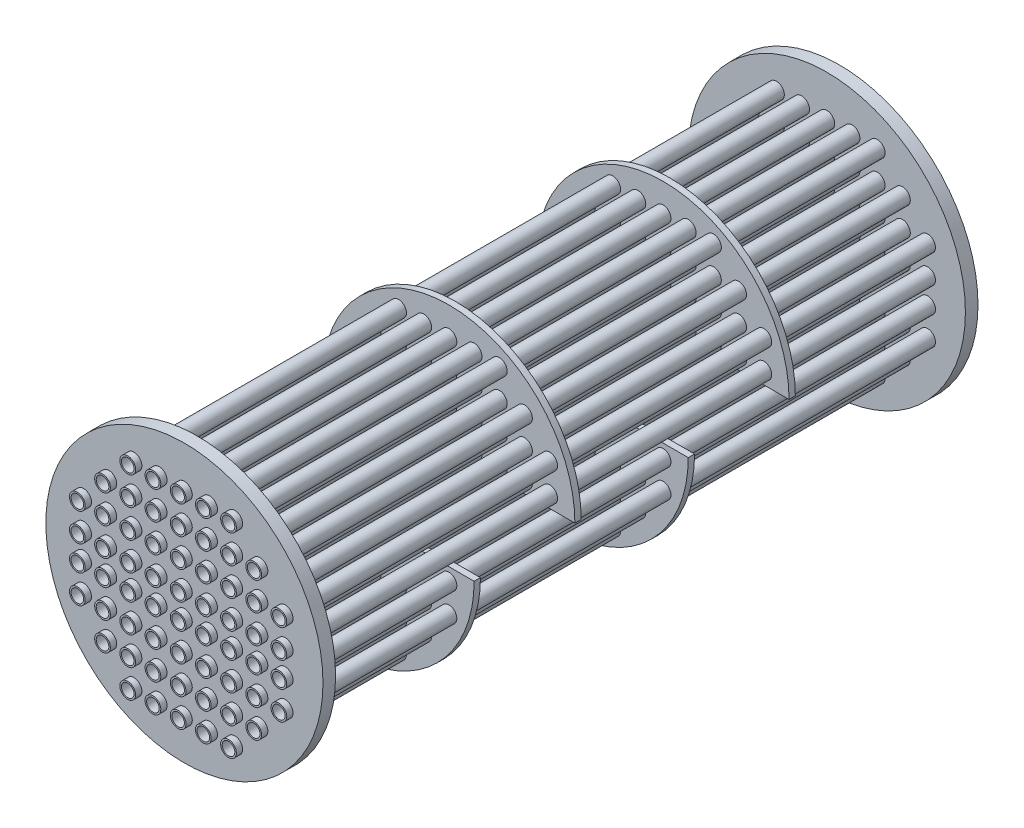
from build123d import *

# Parameters (mm, degrees)
SKETCH1_R              = 220
BOSS_EXTRUDE1_DEPTH    = 20
SKETCH3_R              = 220
BOSS_EXTRUDE2_DEPTH    = 20
BOSS_EXTRUDE3_DEPTH    = 10
BOSS_EXTRUDE4_DEPTH    = 10
BOSS_EXTRUDE5_DEPTH    = 10
BOSS_EXTRUDE6_DEPTH    = 10
SKETCH9_R              = 10
CUT_EXTRUDE1_DEPTH     = 1086.541339609
SKETCH10_R             = 12.5
SKETCH10_R_2           = 10
BOSS_EXTRUDE8_DEPTH    = 1060
BOSS_EXTRUDE8_2_DEPTH  = 1060
BOSS_EXTRUDE8_3_DEPTH  = 1060
BOSS_EXTRUDE8_4_DEPTH  = 1060
BOSS_EXTRUDE8_5_DEPTH  = 1060
BOSS_EXTRUDE8_6_DEPTH  = 1060
BOSS_EXTRUDE8_7_DEPTH  = 1060
BOSS_EXTRUDE8_8_DEPTH  = 1060
BOSS_EXTRUDE8_9_DEPTH  = 1060
BOSS_EXTRUDE8_10_DEPTH = 1060
BOSS_EXTRUDE8_11_DEPTH = 1060
BOSS_EXTRUDE8_12_DEPTH = 1060
BOSS_EXTRUDE8_13_DEPTH = 1060
BOSS_EXTRUDE8_14_DEPTH = 1060
BOSS_EXTRUDE8_15_DEPTH = 1060
BOSS_EXTRUDE8_16_DEPTH = 1060
BOSS_EXTRUDE8_17_DEPTH = 1060
BOSS_EXTRUDE8_18_DEPTH = 1060
BOSS_EXTRUDE8_19_DEPTH = 1060
BOSS_EXTRUDE8_20_DEPTH = 1060
BOSS_EXTRUDE8_21_DEPTH = 1060
BOSS_EXTRUDE8_22_DEPTH = 1060
BOSS_EXTRUDE8_23_DEPTH = 1060
BOSS_EXTRUDE8_24_DEPTH = 1060
BOSS_EXTRUDE8_25_DEPTH = 1060
BOSS_EXTRUDE8_26_DEPTH = 1060
BOSS_EXTRUDE8_27_DEPTH = 1060
BOSS_EXTRUDE8_28_DEPTH = 1060
BOSS_EXTRUDE8_29_DEPTH = 1060
BOSS_EXTRUDE8_30_DEPTH = 1060
BOSS_EXTRUDE8_31_DEPTH = 1060
BOSS_EXTRUDE8_32_DEPTH = 1060
BOSS_EXTRUDE8_33_DEPTH = 1060
BOSS_EXTRUDE8_34_DEPTH = 1060
BOSS_EXTRUDE8_35_DEPTH = 1060
BOSS_EXTRUDE8_36_DEPTH = 1060
BOSS_EXTRUDE8_37_DEPTH = 1060
BOSS_EXTRUDE8_38_DEPTH = 1060
BOSS_EXTRUDE8_39_DEPTH = 1060
BOSS_EXTRUDE8_40_DEPTH = 1060
BOSS_EXTRUDE8_41_DEPTH = 1060
BOSS_EXTRUDE8_42_DEPTH = 1060
BOSS_EXTRUDE8_43_DEPTH = 1060
BOSS_EXTRUDE8_44_DEPTH = 1060
BOSS_EXTRUDE8_45_DEPTH = 1060
BOSS_EXTRUDE8_46_DEPTH = 1060
BOSS_EXTRUDE8_47_DEPTH = 1060
BOSS_EXTRUDE8_48_DEPTH = 1060
BOSS_EXTRUDE8_49_DEPTH = 1060
BOSS_EXTRUDE8_50_DEPTH = 1060
BOSS_EXTRUDE8_51_DEPTH = 1060
BOSS_EXTRUDE8_52_DEPTH = 1060
BOSS_EXTRUDE8_53_DEPTH = 1060
BOSS_EXTRUDE8_54_DEPTH = 1060
BOSS_EXTRUDE8_55_DEPTH = 1060
BOSS_EXTRUDE8_56_DEPTH = 1060
BOSS_EXTRUDE8_57_DEPTH = 1060
BOSS_EXTRUDE8_58_DEPTH = 1060
BOSS_EXTRUDE8_59_DEPTH = 1060
BOSS_EXTRUDE8_60_DEPTH = 1060


with BuildPart() as part:
    # Sketch1 → Boss-Extrude1 (new body)
    with BuildSketch(Plane.XY):
        Circle(SKETCH1_R)
    extrude(amount=BOSS_EXTRUDE1_DEPTH)


with BuildPart() as body_2:
    # Sketch3 → Boss-Extrude2 (new body)
    with BuildSketch(Plane.XY.offset(-1000)):
        Circle(SKETCH3_R)
    extrude(amount=-BOSS_EXTRUDE2_DEPTH)


with BuildPart() as body_3:
    # Sketch4 → Boss-Extrude3 (new body)
    with BuildSketch(Plane.XY.offset(-250)):
        with BuildLine():
            Line((-200, 0), (200, 0))
            ThreePointArc((200, 0), (0, -200), (-200, 0))
        make_face()
    extrude(amount=BOSS_EXTRUDE3_DEPTH)


with BuildPart() as body_4:
    # Sketch5 → Boss-Extrude4 (new body)
    with BuildSketch(Plane.XY.offset(-410)):
        with BuildLine():
            Line((-200, 0), (200, 0))
            ThreePointArc((200, 0), (0, 200), (-200, 0))
        make_face()
    extrude(amount=BOSS_EXTRUDE4_DEPTH)


with BuildPart() as body_5:
    # Sketch6 → Boss-Extrude5 (new body)
    with BuildSketch(Plane.XY.offset(-590)):
        with BuildLine():
            Line((200, 0), (-200, 0))
            ThreePointArc((-200, 0), (0, -200), (200, 0))
        make_face()
    extrude(amount=BOSS_EXTRUDE5_DEPTH)


with BuildPart() as body_6:
    # Sketch8 → Boss-Extrude6 (new body)
    with BuildSketch(Plane.XY.offset(-750)):
        with BuildLine():
            Line((-200, 0), (200, 0))
            ThreePointArc((200, 0), (0, 200), (-200, 0))
        make_face()
    extrude(amount=BOSS_EXTRUDE6_DEPTH)


with BuildPart() as cut_extrude1_tool:
    # Sketch9 → Cut-Extrude1 (new, through all)
    with BuildSketch(Plane.XY.offset(20)):
        with Locations((0, 20)):
            Circle(SKETCH9_R)
        with Locations((0, 65)):
            Circle(SKETCH9_R)
        with Locations((0, 110)):
            Circle(SKETCH9_R)
        with Locations((0, 155)):
            Circle(SKETCH9_R)
        with Locations((40, 20)):
            Circle(SKETCH9_R)
        with Locations((40, 65)):
            Circle(SKETCH9_R)
        with Locations((40, 110)):
            Circle(SKETCH9_R)
        with Locations((40, 155)):
            Circle(SKETCH9_R)
        with Locations((80, 20)):
            Circle(SKETCH9_R)
        with Locations((80, 65)):
            Circle(SKETCH9_R)
        with Locations((80, 110)):
            Circle(SKETCH9_R)
        with Locations((80, 155)):
            Circle(SKETCH9_R)
        with Locations((120, 20)):
            Circle(SKETCH9_R)
        with Locations((120, 65)):
            Circle(SKETCH9_R)
        with Locations((120, 110)):
            Circle(SKETCH9_R)
        with Locations((160, 20)):
            Circle(SKETCH9_R)
        with Locations((160, 65)):
            Circle(SKETCH9_R)
        with Locations((-160, 65)):
            Circle(SKETCH9_R)
        with Locations((-160, 20)):
            Circle(SKETCH9_R)
        with Locations((-120, 110)):
            Circle(SKETCH9_R)
        with Locations((-120, 65)):
            Circle(SKETCH9_R)
        with Locations((-120, 20)):
            Circle(SKETCH9_R)
        with Locations((-80, 155)):
            Circle(SKETCH9_R)
        with Locations((-80, 110)):
            Circle(SKETCH9_R)
        with Locations((-80, 65)):
            Circle(SKETCH9_R)
        with Locations((-80, 20)):
            Circle(SKETCH9_R)
        with Locations((-40, 155)):
            Circle(SKETCH9_R)
        with Locations((-40, 110)):
            Circle(SKETCH9_R)
        with Locations((-40, 65)):
            Circle(SKETCH9_R)
        with Locations((-40, 20)):
            Circle(SKETCH9_R)
        with Locations((-40, -20)):
            Circle(SKETCH9_R)
        with Locations((-40, -65)):
            Circle(SKETCH9_R)
        with Locations((-40, -110)):
            Circle(SKETCH9_R)
        with Locations((-40, -155)):
            Circle(SKETCH9_R)
        with Locations((-80, -20)):
            Circle(SKETCH9_R)
        with Locations((-80, -65)):
            Circle(SKETCH9_R)
        with Locations((-80, -110)):
            Circle(SKETCH9_R)
        with Locations((-80, -155)):
            Circle(SKETCH9_R)
        with Locations((-120, -20)):
            Circle(SKETCH9_R)
        with Locations((-120, -65)):
            Circle(SKETCH9_R)
        with Locations((-120, -110)):
            Circle(SKETCH9_R)
        with Locations((-160, -20)):
            Circle(SKETCH9_R)
        with Locations((-160, -65)):
            Circle(SKETCH9_R)
        with Locations((160, -65)):
            Circle(SKETCH9_R)
        with Locations((160, -20)):
            Circle(SKETCH9_R)
        with Locations((120, -110)):
            Circle(SKETCH9_R)
        with Locations((120, -65)):
            Circle(SKETCH9_R)
        with Locations((120, -20)):
            Circle(SKETCH9_R)
        with Locations((80, -155)):
            Circle(SKETCH9_R)
        with Locations((80, -110)):
            Circle(SKETCH9_R)
        with Locations((80, -65)):
            Circle(SKETCH9_R)
        with Locations((80, -20)):
            Circle(SKETCH9_R)
        with Locations((40, -155)):
            Circle(SKETCH9_R)
        with Locations((40, -110)):
            Circle(SKETCH9_R)
        with Locations((40, -65)):
            Circle(SKETCH9_R)
        with Locations((40, -20)):
            Circle(SKETCH9_R)
        with Locations((0, -155)):
            Circle(SKETCH9_R)
        with Locations((0, -110)):
            Circle(SKETCH9_R)
        with Locations((0, -65)):
            Circle(SKETCH9_R)
        with Locations((0, -20)):
            Circle(SKETCH9_R)
    extrude(amount=-CUT_EXTRUDE1_DEPTH)


with BuildPart() as part_1:
    add(part.part)

    # Cut-Extrude1: cut by cut_extrude1_tool
    add(cut_extrude1_tool.part, mode=Mode.SUBTRACT)


with BuildPart() as body_2_1:
    add(body_2.part)

    # Cut-Extrude1: cut by cut_extrude1_tool
    add(cut_extrude1_tool.part, mode=Mode.SUBTRACT)


with BuildPart() as body_3_1:
    add(body_3.part)

    # Cut-Extrude1: cut by cut_extrude1_tool
    add(cut_extrude1_tool.part, mode=Mode.SUBTRACT)


with BuildPart() as body_4_1:
    add(body_4.part)

    # Cut-Extrude1: cut by cut_extrude1_tool
    add(cut_extrude1_tool.part, mode=Mode.SUBTRACT)


with BuildPart() as body_5_1:
    add(body_5.part)

    # Cut-Extrude1: cut by cut_extrude1_tool
    add(cut_extrude1_tool.part, mode=Mode.SUBTRACT)


with BuildPart() as body_6_1:
    add(body_6.part)

    # Cut-Extrude1: cut by cut_extrude1_tool
    add(cut_extrude1_tool.part, mode=Mode.SUBTRACT)


with BuildPart() as body_7:
    # Sketch10 → Boss-Extrude8 (new body)
    with BuildSketch(Plane.XY.offset(30)):
        with Locations((0, -155)):
            Circle(SKETCH10_R)
        with Locations((0, -155)):
            Circle(SKETCH10_R_2, mode=Mode.SUBTRACT)
    extrude(amount=-BOSS_EXTRUDE8_DEPTH)


with BuildPart() as body_8:
    # Sketch10 → Boss-Extrude8 2 (new body)
    with BuildSketch(Plane.XY.offset(30)):
        with Locations((0, -110)):
            Circle(SKETCH10_R)
        with Locations((0, -110)):
            Circle(SKETCH10_R_2, mode=Mode.SUBTRACT)
    extrude(amount=-BOSS_EXTRUDE8_2_DEPTH)


with BuildPart() as body_9:
    # Sketch10 → Boss-Extrude8 3 (new body)
    with BuildSketch(Plane.XY.offset(30)):
        with Locations((0, -65)):
            Circle(SKETCH10_R)
        with Locations((0, -65)):
            Circle(SKETCH10_R_2, mode=Mode.SUBTRACT)
    extrude(amount=-BOSS_EXTRUDE8_3_DEPTH)


with BuildPart() as body_10:
    # Sketch10 → Boss-Extrude8 4 (new body)
    with BuildSketch(Plane.XY.offset(30)):
        with Locations((0, -20)):
            Circle(SKETCH10_R)
        with Locations((0, -20)):
            Circle(SKETCH10_R_2, mode=Mode.SUBTRACT)
    extrude(amount=-BOSS_EXTRUDE8_4_DEPTH)


with BuildPart() as body_11:
    # Sketch10 → Boss-Extrude8 5 (new body)
    with BuildSketch(Plane.XY.offset(30)):
        with Locations((0, 20)):
            Circle(SKETCH10_R)
        with Locations((0, 20)):
            Circle(SKETCH10_R_2, mode=Mode.SUBTRACT)
    extrude(amount=-BOSS_EXTRUDE8_5_DEPTH)


with BuildPart() as body_12:
    # Sketch10 → Boss-Extrude8 6 (new body)
    with BuildSketch(Plane.XY.offset(30)):
        with Locations((0, 65)):
            Circle(SKETCH10_R)
        with Locations((0, 65)):
            Circle(SKETCH10_R_2, mode=Mode.SUBTRACT)
    extrude(amount=-BOSS_EXTRUDE8_6_DEPTH)


with BuildPart() as body_13:
    # Sketch10 → Boss-Extrude8 7 (new body)
    with BuildSketch(Plane.XY.offset(30)):
        with Locations((0, 110)):
            Circle(SKETCH10_R)
        with Locations((0, 110)):
            Circle(SKETCH10_R_2, mode=Mode.SUBTRACT)
    extrude(amount=-BOSS_EXTRUDE8_7_DEPTH)


with BuildPart() as body_14:
    # Sketch10 → Boss-Extrude8 8 (new body)
    with BuildSketch(Plane.XY.offset(30)):
        with Locations((0, 155)):
            Circle(SKETCH10_R)
        with Locations((0, 155)):
            Circle(SKETCH10_R_2, mode=Mode.SUBTRACT)
    extrude(amount=-BOSS_EXTRUDE8_8_DEPTH)


with BuildPart() as body_15:
    # Sketch10 → Boss-Extrude8 9 (new body)
    with BuildSketch(Plane.XY.offset(30)):
        with Locations((-80, -155)):
            Circle(SKETCH10_R)
        with Locations((-80, -155)):
            Circle(SKETCH10_R_2, mode=Mode.SUBTRACT)
    extrude(amount=-BOSS_EXTRUDE8_9_DEPTH)


with BuildPart() as body_16:
    # Sketch10 → Boss-Extrude8 10 (new body)
    with BuildSketch(Plane.XY.offset(30)):
        with Locations((-40, -155)):
            Circle(SKETCH10_R)
        with Locations((-40, -155)):
            Circle(SKETCH10_R_2, mode=Mode.SUBTRACT)
    extrude(amount=-BOSS_EXTRUDE8_10_DEPTH)


with BuildPart() as body_17:
    # Sketch10 → Boss-Extrude8 11 (new body)
    with BuildSketch(Plane.XY.offset(30)):
        with Locations((80, -155)):
            Circle(SKETCH10_R)
        with Locations((80, -155)):
            Circle(SKETCH10_R_2, mode=Mode.SUBTRACT)
    extrude(amount=-BOSS_EXTRUDE8_11_DEPTH)


with BuildPart() as body_18:
    # Sketch10 → Boss-Extrude8 12 (new body)
    with BuildSketch(Plane.XY.offset(30)):
        with Locations((40, -155)):
            Circle(SKETCH10_R)
        with Locations((40, -155)):
            Circle(SKETCH10_R_2, mode=Mode.SUBTRACT)
    extrude(amount=-BOSS_EXTRUDE8_12_DEPTH)


with BuildPart() as body_19:
    # Sketch10 → Boss-Extrude8 13 (new body)
    with BuildSketch(Plane.XY.offset(30)):
        with Locations((-80, 20)):
            Circle(SKETCH10_R)
        with Locations((-80, 20)):
            Circle(SKETCH10_R_2, mode=Mode.SUBTRACT)
    extrude(amount=-BOSS_EXTRUDE8_13_DEPTH)


with BuildPart() as body_20:
    # Sketch10 → Boss-Extrude8 14 (new body)
    with BuildSketch(Plane.XY.offset(30)):
        with Locations((-40, 20)):
            Circle(SKETCH10_R)
        with Locations((-40, 20)):
            Circle(SKETCH10_R_2, mode=Mode.SUBTRACT)
    extrude(amount=-BOSS_EXTRUDE8_14_DEPTH)


with BuildPart() as body_21:
    # Sketch10 → Boss-Extrude8 15 (new body)
    with BuildSketch(Plane.XY.offset(30)):
        with Locations((-80, -110)):
            Circle(SKETCH10_R)
        with Locations((-80, -110)):
            Circle(SKETCH10_R_2, mode=Mode.SUBTRACT)
    extrude(amount=-BOSS_EXTRUDE8_15_DEPTH)


with BuildPart() as body_22:
    # Sketch10 → Boss-Extrude8 16 (new body)
    with BuildSketch(Plane.XY.offset(30)):
        with Locations((-120, -110)):
            Circle(SKETCH10_R)
        with Locations((-120, -110)):
            Circle(SKETCH10_R_2, mode=Mode.SUBTRACT)
    extrude(amount=-BOSS_EXTRUDE8_16_DEPTH)


with BuildPart() as body_23:
    # Sketch10 → Boss-Extrude8 17 (new body)
    with BuildSketch(Plane.XY.offset(30)):
        with Locations((-120, -65)):
            Circle(SKETCH10_R)
        with Locations((-120, -65)):
            Circle(SKETCH10_R_2, mode=Mode.SUBTRACT)
    extrude(amount=-BOSS_EXTRUDE8_17_DEPTH)


with BuildPart() as body_24:
    # Sketch10 → Boss-Extrude8 18 (new body)
    with BuildSketch(Plane.XY.offset(30)):
        with Locations((-120, -20)):
            Circle(SKETCH10_R)
        with Locations((-120, -20)):
            Circle(SKETCH10_R_2, mode=Mode.SUBTRACT)
    extrude(amount=-BOSS_EXTRUDE8_18_DEPTH)


with BuildPart() as body_25:
    # Sketch10 → Boss-Extrude8 19 (new body)
    with BuildSketch(Plane.XY.offset(30)):
        with Locations((-160, -65)):
            Circle(SKETCH10_R)
        with Locations((-160, -65)):
            Circle(SKETCH10_R_2, mode=Mode.SUBTRACT)
    extrude(amount=-BOSS_EXTRUDE8_19_DEPTH)


with BuildPart() as body_26:
    # Sketch10 → Boss-Extrude8 20 (new body)
    with BuildSketch(Plane.XY.offset(30)):
        with Locations((-160, -20)):
            Circle(SKETCH10_R)
        with Locations((-160, -20)):
            Circle(SKETCH10_R_2, mode=Mode.SUBTRACT)
    extrude(amount=-BOSS_EXTRUDE8_20_DEPTH)


with BuildPart() as body_27:
    # Sketch10 → Boss-Extrude8 21 (new body)
    with BuildSketch(Plane.XY.offset(30)):
        with Locations((-160, 20)):
            Circle(SKETCH10_R)
        with Locations((-160, 20)):
            Circle(SKETCH10_R_2, mode=Mode.SUBTRACT)
    extrude(amount=-BOSS_EXTRUDE8_21_DEPTH)


with BuildPart() as body_28:
    # Sketch10 → Boss-Extrude8 22 (new body)
    with BuildSketch(Plane.XY.offset(30)):
        with Locations((-120, 20)):
            Circle(SKETCH10_R)
        with Locations((-120, 20)):
            Circle(SKETCH10_R_2, mode=Mode.SUBTRACT)
    extrude(amount=-BOSS_EXTRUDE8_22_DEPTH)


with BuildPart() as body_29:
    # Sketch10 → Boss-Extrude8 23 (new body)
    with BuildSketch(Plane.XY.offset(30)):
        with Locations((-40, -110)):
            Circle(SKETCH10_R)
        with Locations((-40, -110)):
            Circle(SKETCH10_R_2, mode=Mode.SUBTRACT)
    extrude(amount=-BOSS_EXTRUDE8_23_DEPTH)


with BuildPart() as body_30:
    # Sketch10 → Boss-Extrude8 24 (new body)
    with BuildSketch(Plane.XY.offset(30)):
        with Locations((-40, -20)):
            Circle(SKETCH10_R)
        with Locations((-40, -20)):
            Circle(SKETCH10_R_2, mode=Mode.SUBTRACT)
    extrude(amount=-BOSS_EXTRUDE8_24_DEPTH)


with BuildPart() as body_31:
    # Sketch10 → Boss-Extrude8 25 (new body)
    with BuildSketch(Plane.XY.offset(30)):
        with Locations((-40, -65)):
            Circle(SKETCH10_R)
        with Locations((-40, -65)):
            Circle(SKETCH10_R_2, mode=Mode.SUBTRACT)
    extrude(amount=-BOSS_EXTRUDE8_25_DEPTH)


with BuildPart() as body_32:
    # Sketch10 → Boss-Extrude8 26 (new body)
    with BuildSketch(Plane.XY.offset(30)):
        with Locations((-80, -65)):
            Circle(SKETCH10_R)
        with Locations((-80, -65)):
            Circle(SKETCH10_R_2, mode=Mode.SUBTRACT)
    extrude(amount=-BOSS_EXTRUDE8_26_DEPTH)


with BuildPart() as body_33:
    # Sketch10 → Boss-Extrude8 27 (new body)
    with BuildSketch(Plane.XY.offset(30)):
        with Locations((-80, -20)):
            Circle(SKETCH10_R)
        with Locations((-80, -20)):
            Circle(SKETCH10_R_2, mode=Mode.SUBTRACT)
    extrude(amount=-BOSS_EXTRUDE8_27_DEPTH)


with BuildPart() as body_34:
    # Sketch10 → Boss-Extrude8 28 (new body)
    with BuildSketch(Plane.XY.offset(30)):
        with Locations((160, -20)):
            Circle(SKETCH10_R)
        with Locations((160, -20)):
            Circle(SKETCH10_R_2, mode=Mode.SUBTRACT)
    extrude(amount=-BOSS_EXTRUDE8_28_DEPTH)


with BuildPart() as body_35:
    # Sketch10 → Boss-Extrude8 29 (new body)
    with BuildSketch(Plane.XY.offset(30)):
        with Locations((160, 20)):
            Circle(SKETCH10_R)
        with Locations((160, 20)):
            Circle(SKETCH10_R_2, mode=Mode.SUBTRACT)
    extrude(amount=-BOSS_EXTRUDE8_29_DEPTH)


with BuildPart() as body_36:
    # Sketch10 → Boss-Extrude8 30 (new body)
    with BuildSketch(Plane.XY.offset(30)):
        with Locations((120, 20)):
            Circle(SKETCH10_R)
        with Locations((120, 20)):
            Circle(SKETCH10_R_2, mode=Mode.SUBTRACT)
    extrude(amount=-BOSS_EXTRUDE8_30_DEPTH)


with BuildPart() as body_37:
    # Sketch10 → Boss-Extrude8 31 (new body)
    with BuildSketch(Plane.XY.offset(30)):
        with Locations((80, 20)):
            Circle(SKETCH10_R)
        with Locations((80, 20)):
            Circle(SKETCH10_R_2, mode=Mode.SUBTRACT)
    extrude(amount=-BOSS_EXTRUDE8_31_DEPTH)


with BuildPart() as body_38:
    # Sketch10 → Boss-Extrude8 32 (new body)
    with BuildSketch(Plane.XY.offset(30)):
        with Locations((80, -20)):
            Circle(SKETCH10_R)
        with Locations((80, -20)):
            Circle(SKETCH10_R_2, mode=Mode.SUBTRACT)
    extrude(amount=-BOSS_EXTRUDE8_32_DEPTH)


with BuildPart() as body_39:
    # Sketch10 → Boss-Extrude8 33 (new body)
    with BuildSketch(Plane.XY.offset(30)):
        with Locations((40, -110)):
            Circle(SKETCH10_R)
        with Locations((40, -110)):
            Circle(SKETCH10_R_2, mode=Mode.SUBTRACT)
    extrude(amount=-BOSS_EXTRUDE8_33_DEPTH)


with BuildPart() as body_40:
    # Sketch10 → Boss-Extrude8 34 (new body)
    with BuildSketch(Plane.XY.offset(30)):
        with Locations((40, -65)):
            Circle(SKETCH10_R)
        with Locations((40, -65)):
            Circle(SKETCH10_R_2, mode=Mode.SUBTRACT)
    extrude(amount=-BOSS_EXTRUDE8_34_DEPTH)


with BuildPart() as body_41:
    # Sketch10 → Boss-Extrude8 35 (new body)
    with BuildSketch(Plane.XY.offset(30)):
        with Locations((40, -20)):
            Circle(SKETCH10_R)
        with Locations((40, -20)):
            Circle(SKETCH10_R_2, mode=Mode.SUBTRACT)
    extrude(amount=-BOSS_EXTRUDE8_35_DEPTH)


with BuildPart() as body_42:
    # Sketch10 → Boss-Extrude8 36 (new body)
    with BuildSketch(Plane.XY.offset(30)):
        with Locations((40, 20)):
            Circle(SKETCH10_R)
        with Locations((40, 20)):
            Circle(SKETCH10_R_2, mode=Mode.SUBTRACT)
    extrude(amount=-BOSS_EXTRUDE8_36_DEPTH)


with BuildPart() as body_43:
    # Sketch10 → Boss-Extrude8 37 (new body)
    with BuildSketch(Plane.XY.offset(30)):
        with Locations((160, -65)):
            Circle(SKETCH10_R)
        with Locations((160, -65)):
            Circle(SKETCH10_R_2, mode=Mode.SUBTRACT)
    extrude(amount=-BOSS_EXTRUDE8_37_DEPTH)


with BuildPart() as body_44:
    # Sketch10 → Boss-Extrude8 38 (new body)
    with BuildSketch(Plane.XY.offset(30)):
        with Locations((120, -65)):
            Circle(SKETCH10_R)
        with Locations((120, -65)):
            Circle(SKETCH10_R_2, mode=Mode.SUBTRACT)
    extrude(amount=-BOSS_EXTRUDE8_38_DEPTH)


with BuildPart() as body_45:
    # Sketch10 → Boss-Extrude8 39 (new body)
    with BuildSketch(Plane.XY.offset(30)):
        with Locations((120, -110)):
            Circle(SKETCH10_R)
        with Locations((120, -110)):
            Circle(SKETCH10_R_2, mode=Mode.SUBTRACT)
    extrude(amount=-BOSS_EXTRUDE8_39_DEPTH)


with BuildPart() as body_46:
    # Sketch10 → Boss-Extrude8 40 (new body)
    with BuildSketch(Plane.XY.offset(30)):
        with Locations((80, -110)):
            Circle(SKETCH10_R)
        with Locations((80, -110)):
            Circle(SKETCH10_R_2, mode=Mode.SUBTRACT)
    extrude(amount=-BOSS_EXTRUDE8_40_DEPTH)


with BuildPart() as body_47:
    # Sketch10 → Boss-Extrude8 41 (new body)
    with BuildSketch(Plane.XY.offset(30)):
        with Locations((80, -65)):
            Circle(SKETCH10_R)
        with Locations((80, -65)):
            Circle(SKETCH10_R_2, mode=Mode.SUBTRACT)
    extrude(amount=-BOSS_EXTRUDE8_41_DEPTH)


with BuildPart() as body_48:
    # Sketch10 → Boss-Extrude8 42 (new body)
    with BuildSketch(Plane.XY.offset(30)):
        with Locations((120, -20)):
            Circle(SKETCH10_R)
        with Locations((120, -20)):
            Circle(SKETCH10_R_2, mode=Mode.SUBTRACT)
    extrude(amount=-BOSS_EXTRUDE8_42_DEPTH)


with BuildPart() as body_49:
    # Sketch10 → Boss-Extrude8 43 (new body)
    with BuildSketch(Plane.XY.offset(30)):
        with Locations((-120, 65)):
            Circle(SKETCH10_R)
        with Locations((-120, 65)):
            Circle(SKETCH10_R_2, mode=Mode.SUBTRACT)
    extrude(amount=-BOSS_EXTRUDE8_43_DEPTH)


with BuildPart() as body_50:
    # Sketch10 → Boss-Extrude8 44 (new body)
    with BuildSketch(Plane.XY.offset(30)):
        with Locations((-160, 65)):
            Circle(SKETCH10_R)
        with Locations((-160, 65)):
            Circle(SKETCH10_R_2, mode=Mode.SUBTRACT)
    extrude(amount=-BOSS_EXTRUDE8_44_DEPTH)


with BuildPart() as body_51:
    # Sketch10 → Boss-Extrude8 45 (new body)
    with BuildSketch(Plane.XY.offset(30)):
        with Locations((-80, 65)):
            Circle(SKETCH10_R)
        with Locations((-80, 65)):
            Circle(SKETCH10_R_2, mode=Mode.SUBTRACT)
    extrude(amount=-BOSS_EXTRUDE8_45_DEPTH)


with BuildPart() as body_52:
    # Sketch10 → Boss-Extrude8 46 (new body)
    with BuildSketch(Plane.XY.offset(30)):
        with Locations((-40, 65)):
            Circle(SKETCH10_R)
        with Locations((-40, 65)):
            Circle(SKETCH10_R_2, mode=Mode.SUBTRACT)
    extrude(amount=-BOSS_EXTRUDE8_46_DEPTH)


with BuildPart() as body_53:
    # Sketch10 → Boss-Extrude8 47 (new body)
    with BuildSketch(Plane.XY.offset(30)):
        with Locations((40, 65)):
            Circle(SKETCH10_R)
        with Locations((40, 65)):
            Circle(SKETCH10_R_2, mode=Mode.SUBTRACT)
    extrude(amount=-BOSS_EXTRUDE8_47_DEPTH)


with BuildPart() as body_54:
    # Sketch10 → Boss-Extrude8 48 (new body)
    with BuildSketch(Plane.XY.offset(30)):
        with Locations((80, 65)):
            Circle(SKETCH10_R)
        with Locations((80, 65)):
            Circle(SKETCH10_R_2, mode=Mode.SUBTRACT)
    extrude(amount=-BOSS_EXTRUDE8_48_DEPTH)


with BuildPart() as body_55:
    # Sketch10 → Boss-Extrude8 49 (new body)
    with BuildSketch(Plane.XY.offset(30)):
        with Locations((120, 65)):
            Circle(SKETCH10_R)
        with Locations((120, 65)):
            Circle(SKETCH10_R_2, mode=Mode.SUBTRACT)
    extrude(amount=-BOSS_EXTRUDE8_49_DEPTH)


with BuildPart() as body_56:
    # Sketch10 → Boss-Extrude8 50 (new body)
    with BuildSketch(Plane.XY.offset(30)):
        with Locations((160, 65)):
            Circle(SKETCH10_R)
        with Locations((160, 65)):
            Circle(SKETCH10_R_2, mode=Mode.SUBTRACT)
    extrude(amount=-BOSS_EXTRUDE8_50_DEPTH)


with BuildPart() as body_57:
    # Sketch10 → Boss-Extrude8 51 (new body)
    with BuildSketch(Plane.XY.offset(30)):
        with Locations((-120, 110)):
            Circle(SKETCH10_R)
        with Locations((-120, 110)):
            Circle(SKETCH10_R_2, mode=Mode.SUBTRACT)
    extrude(amount=-BOSS_EXTRUDE8_51_DEPTH)


with BuildPart() as body_58:
    # Sketch10 → Boss-Extrude8 52 (new body)
    with BuildSketch(Plane.XY.offset(30)):
        with Locations((-80, 110)):
            Circle(SKETCH10_R)
        with Locations((-80, 110)):
            Circle(SKETCH10_R_2, mode=Mode.SUBTRACT)
    extrude(amount=-BOSS_EXTRUDE8_52_DEPTH)


with BuildPart() as body_59:
    # Sketch10 → Boss-Extrude8 53 (new body)
    with BuildSketch(Plane.XY.offset(30)):
        with Locations((-40, 110)):
            Circle(SKETCH10_R)
        with Locations((-40, 110)):
            Circle(SKETCH10_R_2, mode=Mode.SUBTRACT)
    extrude(amount=-BOSS_EXTRUDE8_53_DEPTH)


with BuildPart() as body_60:
    # Sketch10 → Boss-Extrude8 54 (new body)
    with BuildSketch(Plane.XY.offset(30)):
        with Locations((40, 110)):
            Circle(SKETCH10_R)
        with Locations((40, 110)):
            Circle(SKETCH10_R_2, mode=Mode.SUBTRACT)
    extrude(amount=-BOSS_EXTRUDE8_54_DEPTH)


with BuildPart() as body_61:
    # Sketch10 → Boss-Extrude8 55 (new body)
    with BuildSketch(Plane.XY.offset(30)):
        with Locations((80, 110)):
            Circle(SKETCH10_R)
        with Locations((80, 110)):
            Circle(SKETCH10_R_2, mode=Mode.SUBTRACT)
    extrude(amount=-BOSS_EXTRUDE8_55_DEPTH)


with BuildPart() as body_62:
    # Sketch10 → Boss-Extrude8 56 (new body)
    with BuildSketch(Plane.XY.offset(30)):
        with Locations((120, 110)):
            Circle(SKETCH10_R)
        with Locations((120, 110)):
            Circle(SKETCH10_R_2, mode=Mode.SUBTRACT)
    extrude(amount=-BOSS_EXTRUDE8_56_DEPTH)


with BuildPart() as body_63:
    # Sketch10 → Boss-Extrude8 57 (new body)
    with BuildSketch(Plane.XY.offset(30)):
        with Locations((80, 155)):
            Circle(SKETCH10_R)
        with Locations((80, 155)):
            Circle(SKETCH10_R_2, mode=Mode.SUBTRACT)
    extrude(amount=-BOSS_EXTRUDE8_57_DEPTH)


with BuildPart() as body_64:
    # Sketch10 → Boss-Extrude8 58 (new body)
    with BuildSketch(Plane.XY.offset(30)):
        with Locations((40, 155)):
            Circle(SKETCH10_R)
        with Locations((40, 155)):
            Circle(SKETCH10_R_2, mode=Mode.SUBTRACT)
    extrude(amount=-BOSS_EXTRUDE8_58_DEPTH)


with BuildPart() as body_65:
    # Sketch10 → Boss-Extrude8 59 (new body)
    with BuildSketch(Plane.XY.offset(30)):
        with Locations((-40, 155)):
            Circle(SKETCH10_R)
        with Locations((-40, 155)):
            Circle(SKETCH10_R_2, mode=Mode.SUBTRACT)
    extrude(amount=-BOSS_EXTRUDE8_59_DEPTH)


with BuildPart() as body_66:
    # Sketch10 → Boss-Extrude8 60 (new body)
    with BuildSketch(Plane.XY.offset(30)):
        with Locations((-80, 155)):
            Circle(SKETCH10_R)
        with Locations((-80, 155)):
            Circle(SKETCH10_R_2, mode=Mode.SUBTRACT)
    extrude(amount=-BOSS_EXTRUDE8_60_DEPTH)


solid = Compound([part_1.part, body_2_1.part, body_3_1.part, body_4_1.part, body_5_1.part, body_6_1.part, body_7.part, body_8.part, body_9.part, body_10.part, body_11.part, body_12.part, body_13.part, body_14.part, body_15.part, body_16.part, body_17.part, body_18.part, body_19.part, body_20.part, body_21.part, body_22.part, body_23.part, body_24.part, body_25.part, body_26.part, body_27.part, body_28.part, body_29.part, body_30.part, body_31.part, body_32.part, body_33.part, body_34.part, body_35.part, body_36.part, body_37.part, body_38.part, body_39.part, body_40.part, body_41.part, body_42.part, body_43.part, body_44.part, body_45.part, body_46.part, body_47.part, body_48.part, body_49.part, body_50.part, body_51.part, body_52.part, body_53.part, body_54.part, body_55.part, body_56.part, body_57.part, body_58.part, body_59.part, body_60.part, body_61.part, body_62.part, body_63.part, body_64.part, body_65.part, body_66.part])
